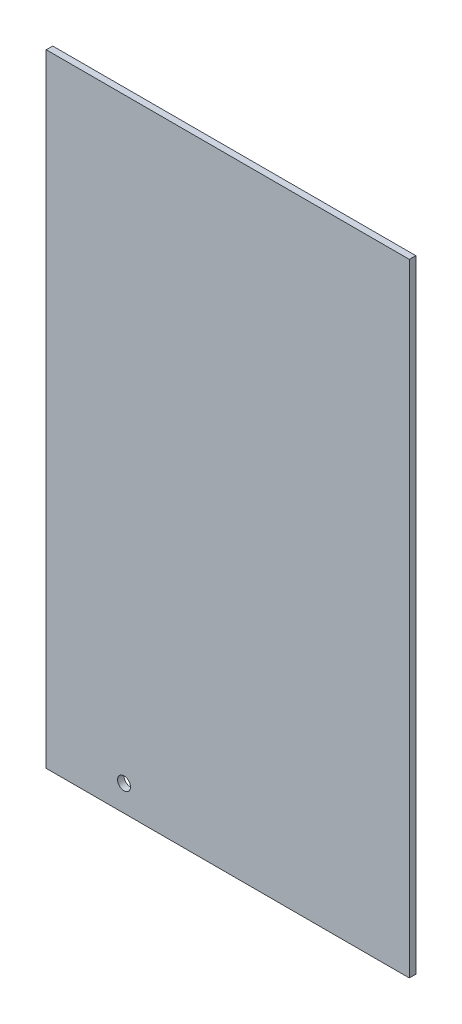
from build123d import *

# Parameters (mm, degrees)
SKETCH1_W           = 177.8
SKETCH1_H           = 304.8
SKETCH1_R           = 3.175
BOSS_EXTRUDE1_DEPTH = 3.175


with BuildPart() as part:
    # Sketch1 → Boss-Extrude1 (new body)
    with BuildSketch(Plane.XY):
        with Locations((88.9, 152.4)):
            Rectangle(SKETCH1_W, SKETCH1_H)
        with Locations((38.1, 12.7)):
            Circle(SKETCH1_R, mode=Mode.SUBTRACT)
    extrude(amount=BOSS_EXTRUDE1_DEPTH)


solid = part.part
